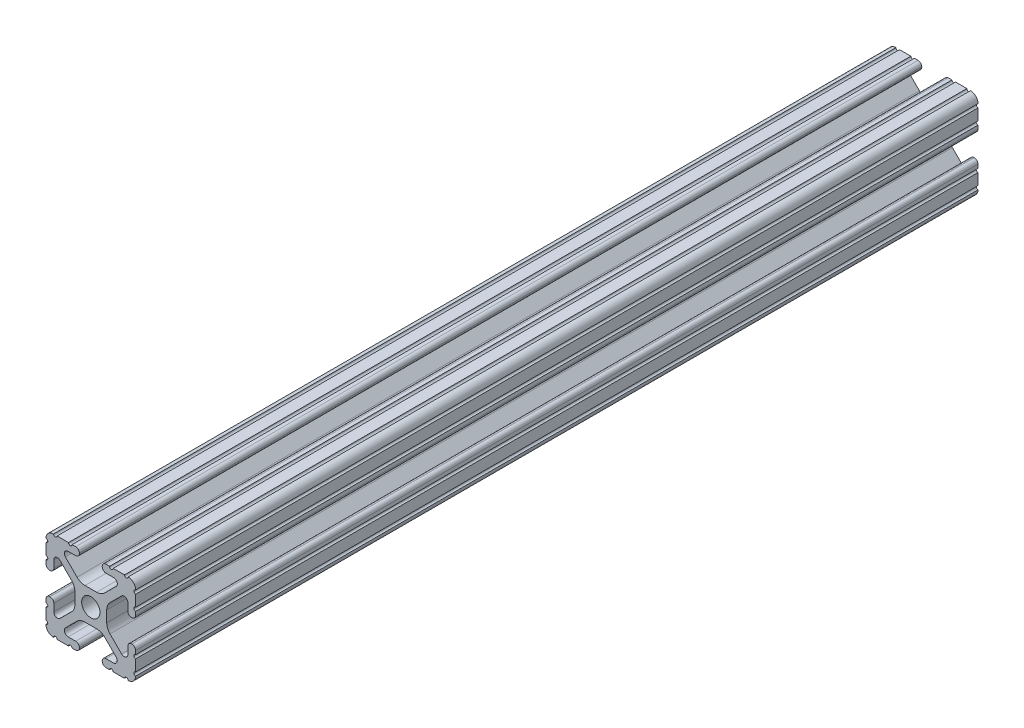
from build123d import *

# Parameters (mm, degrees)
SKETCH1_R           = 2.6035
BOSS_EXTRUDE1_DEPTH = 119.38


with BuildPart() as part:
    # Sketch1 → Boss-Extrude1 (new, symmetric)
    with BuildSketch(Plane.XY):
        with BuildLine():
            Line((-7.179650497, -8.645192506), (-3.952270251, -5.423690499))
            ThreePointArc((-3.952270251, -5.423690499), (-2.922936451, -4.736929036), (-1.709253557, -4.4958))
            Line((-1.709253557, -4.4958), (1.709253557, -4.4958))
            ThreePointArc((1.709253557, -4.4958), (2.922936451, -4.736929036), (3.952270251, -5.423690499))
            Line((3.952270251, -5.423690499), (7.179650497, -8.645192506))
            ThreePointArc((7.179650497, -8.645192506), (7.41473083, -9.822813117), (6.416408329, -10.4902))
            Line((6.416408329, -10.4902), (4.287512407, -10.4902))
            ThreePointArc((4.287512407, -10.4902), (3.54574862, -10.79744862), (3.2385, -11.539212407))
            Line((3.2385, -11.539212407), (3.2385, -11.650987593))
            ThreePointArc((3.2385, -11.650987593), (3.54574862, -12.39275138), (4.287512407, -12.7))
            Line((4.287512407, -12.7), (5.317126718, -12.7))
            ThreePointArc((5.317126718, -12.7), (5.825126718, -12.192), (6.333126718, -12.7))
            Line((6.333126718, -12.7), (9.550443118, -12.7))
            ThreePointArc((9.550443118, -12.7), (10.058366869, -12.192000006), (10.566443095, -12.699847501))
            ThreePointArc((10.566443095, -12.699847501), (12.082537762, -12.08250727), (12.699846982, -10.566399977))
            ThreePointArc((12.699846982, -10.566399977), (12.192000006, -10.058323491), (12.7, -9.5504))
            Line((12.7, -9.5504), (12.7, -6.3330836))
            ThreePointArc((12.7, -6.3330836), (12.192, -5.8250836), (12.7, -5.3170836))
            Line((12.7, -5.3170836), (12.7, -4.287469289))
            ThreePointArc((12.7, -4.287469289), (12.39275138, -3.545705502), (11.650987593, -3.238456882))
            Line((11.650987593, -3.238456882), (11.539212407, -3.238456882))
            ThreePointArc((11.539212407, -3.238456882), (10.79744862, -3.545705502), (10.4902, -4.287469289))
            Line((10.4902, -4.287469289), (10.4902, -6.402089023))
            ThreePointArc((10.4902, -6.402089023), (9.856505071, -7.351067942), (8.737131347, -7.129408934))
            Line((8.737131347, -7.129408934), (5.441005833, -3.840816462))
            ThreePointArc((5.441005833, -3.840816462), (4.750877967, -2.809883091), (4.5085, -1.593185507))
            Line((4.5085, -1.593185507), (4.5085, 1.593185507))
            ThreePointArc((4.5085, 1.593185507), (4.750877967, 2.809883091), (5.441005833, 3.840816462))
            Line((5.441005833, 3.840816462), (8.737131347, 7.129408934))
            ThreePointArc((8.737131347, 7.129408934), (9.856505071, 7.351067942), (10.4902, 6.402089023))
            Line((10.4902, 6.402089023), (10.4902, 4.287469289))
            ThreePointArc((10.4902, 4.287469289), (10.79744862, 3.545705502), (11.539212407, 3.238456882))
            Line((11.539212407, 3.238456882), (11.650987593, 3.238456882))
            ThreePointArc((11.650987593, 3.238456882), (12.39275138, 3.545705502), (12.7, 4.287469289))
            Line((12.7, 4.287469289), (12.7, 5.3170836))
            ThreePointArc((12.7, 5.3170836), (12.192, 5.8250836), (12.7, 6.3330836))
            Line((12.7, 6.3330836), (12.7, 9.5504))
            ThreePointArc((12.7, 9.5504), (12.192000006, 10.058323491), (12.699846982, 10.566399977))
            ThreePointArc((12.699846982, 10.566399977), (12.082537762, 12.08250727), (10.566443095, 12.699847501))
            ThreePointArc((10.566443095, 12.699847501), (10.058366869, 12.192000006), (9.550443118, 12.7))
            Line((9.550443118, 12.7), (6.333126718, 12.7))
            ThreePointArc((6.333126718, 12.7), (5.825126718, 12.192), (5.317126718, 12.7))
            Line((5.317126718, 12.7), (4.287512407, 12.7))
            ThreePointArc((4.287512407, 12.7), (3.54574862, 12.39275138), (3.2385, 11.650987593))
            Line((3.2385, 11.650987593), (3.2385, 11.539212407))
            ThreePointArc((3.2385, 11.539212407), (3.54574862, 10.79744862), (4.287512407, 10.4902))
            Line((4.287512407, 10.4902), (6.476788598, 10.4902))
            ThreePointArc((6.476788598, 10.4902), (7.432222385, 9.85140422), (7.207036008, 8.724370562))
            Line((7.207036008, 8.724370562), (3.898272566, 5.423169045))
            ThreePointArc((3.898272566, 5.423169045), (2.869120213, 4.736787962), (1.655778399, 4.4958))
            Line((1.655778399, 4.4958), (-1.655778399, 4.4958))
            ThreePointArc((-1.655778399, 4.4958), (-2.869120213, 4.736787962), (-3.898272566, 5.423169045))
            Line((-3.898272566, 5.423169045), (-7.207036008, 8.724370562))
            ThreePointArc((-7.207036008, 8.724370562), (-7.432222385, 9.85140422), (-6.476788598, 10.4902))
            Line((-6.476788598, 10.4902), (-4.287512407, 10.4902))
            ThreePointArc((-4.287512407, 10.4902), (-3.54574862, 10.79744862), (-3.2385, 11.539212407))
            Line((-3.2385, 11.539212407), (-3.2385, 11.650987593))
            ThreePointArc((-3.2385, 11.650987593), (-3.54574862, 12.39275138), (-4.287512407, 12.7))
            Line((-4.287512407, 12.7), (-5.317126718, 12.7))
            ThreePointArc((-5.317126718, 12.7), (-5.825126718, 12.192), (-6.333126718, 12.7))
            Line((-6.333126718, 12.7), (-9.550443118, 12.7))
            ThreePointArc((-9.550443118, 12.7), (-10.058366869, 12.192000006), (-10.566443095, 12.699847501))
            ThreePointArc((-10.566443095, 12.699847501), (-12.082537762, 12.08250727), (-12.699846982, 10.566399977))
            ThreePointArc((-12.699846982, 10.566399977), (-12.192000006, 10.058323491), (-12.7, 9.5504))
            Line((-12.7, 9.5504), (-12.7, 6.3330836))
            ThreePointArc((-12.7, 6.3330836), (-12.192, 5.8250836), (-12.7, 5.3170836))
            Line((-12.7, 5.3170836), (-12.7, 4.287469289))
            ThreePointArc((-12.7, 4.287469289), (-12.39275138, 3.545705502), (-11.650987593, 3.238456882))
            Line((-11.650987593, 3.238456882), (-11.539212407, 3.238456882))
            ThreePointArc((-11.539212407, 3.238456882), (-10.79744862, 3.545705502), (-10.4902, 4.287469289))
            Line((-10.4902, 4.287469289), (-10.4902, 6.402089023))
            ThreePointArc((-10.4902, 6.402089023), (-9.856505071, 7.351067942), (-8.737131347, 7.129408934))
            Line((-8.737131347, 7.129408934), (-5.441005833, 3.840816462))
            ThreePointArc((-5.441005833, 3.840816462), (-4.750877967, 2.809883091), (-4.5085, 1.593185507))
            Line((-4.5085, 1.593185507), (-4.5085, -1.593185507))
            ThreePointArc((-4.5085, -1.593185507), (-4.750877967, -2.809883091), (-5.441005833, -3.840816462))
            Line((-5.441005833, -3.840816462), (-8.737131347, -7.129408934))
            ThreePointArc((-8.737131347, -7.129408934), (-9.856505071, -7.351067942), (-10.4902, -6.402089023))
            Line((-10.4902, -6.402089023), (-10.4902, -4.287469289))
            ThreePointArc((-10.4902, -4.287469289), (-10.79744862, -3.545705502), (-11.539212407, -3.238456882))
            Line((-11.539212407, -3.238456882), (-11.650987593, -3.238456882))
            ThreePointArc((-11.650987593, -3.238456882), (-12.39275138, -3.545705502), (-12.7, -4.287469289))
            Line((-12.7, -4.287469289), (-12.7, -5.3170836))
            ThreePointArc((-12.7, -5.3170836), (-12.192, -5.8250836), (-12.7, -6.3330836))
            Line((-12.7, -6.3330836), (-12.7, -9.5504))
            ThreePointArc((-12.7, -9.5504), (-12.192000006, -10.058323491), (-12.699846982, -10.566399977))
            ThreePointArc((-12.699846982, -10.566399977), (-12.082537762, -12.08250727), (-10.566443095, -12.699847501))
            ThreePointArc((-10.566443095, -12.699847501), (-10.058366869, -12.192000006), (-9.550443118, -12.7))
            Line((-9.550443118, -12.7), (-6.333126718, -12.7))
            ThreePointArc((-6.333126718, -12.7), (-5.825126718, -12.192), (-5.317126718, -12.7))
            Line((-5.317126718, -12.7), (-4.287512407, -12.7))
            ThreePointArc((-4.287512407, -12.7), (-3.54574862, -12.39275138), (-3.2385, -11.650987593))
            Line((-3.2385, -11.650987593), (-3.2385, -11.539212407))
            ThreePointArc((-3.2385, -11.539212407), (-3.54574862, -10.79744862), (-4.287512407, -10.4902))
            Line((-4.287512407, -10.4902), (-6.416408329, -10.4902))
            ThreePointArc((-6.416408329, -10.4902), (-7.41473083, -9.822813117), (-7.179650497, -8.645192506))
        make_face()
        with Locations(Location((0, 0, 0), (0, 0, 180))):
            Circle(SKETCH1_R, mode=Mode.SUBTRACT)
    extrude(amount=BOSS_EXTRUDE1_DEPTH, both=True)


solid = part.part
